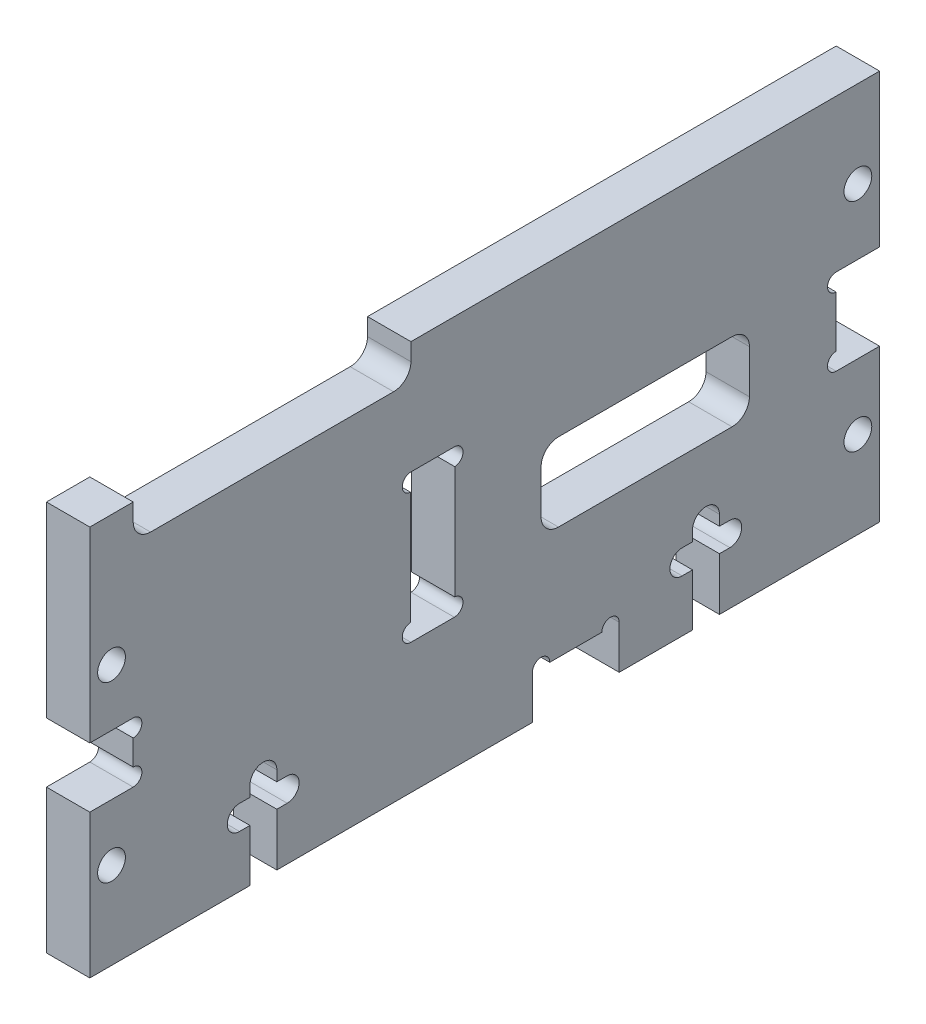
from build123d import *

# Parameters (mm, degrees)
SKETCH_1_W           = 91
SKETCH_1_H           = 45
EXTRUDE_1_DEPTH      = 5
SKETCH_7_W           = 24
SKETCH_7_H           = 9
CUT_EXTRUDE_3_DEPTH  = 10
FILLET_1_R           = 2
SKETCH_8_W           = 32
SKETCH_8_H           = 4
CUT_EXTRUDE_4_DEPTH  = 10
FILLET_2_R           = 2
SKETCH_9_W           = 5
SKETCH_9_H           = 17
CUT_EXTRUDE_5_DEPTH  = 5
SKETCH_14_R          = 1.55
SKETCH_14_R_2        = 1.482519405
CUT_EXTRUDE_9_DEPTH  = 10
SKETCH_10_R          = 1
CUT_EXTRUDE_6_DEPTH  = 10
SKETCH_12_R          = 1.6
CUT_EXTRUDE_7_DEPTH  = 10
CUT_EXTRUDE_8_DEPTH  = 10
SKETCH_15_W          = 10
SKETCH_15_H          = 5
CUT_EXTRUDE_10_DEPTH = 10
SKETCH_19_W          = 5
SKETCH_19_H          = 6.9
SKETCH_19_H_2        = 9.9
CUT_EXTRUDE_14_DEPTH = 5
SKETCH_16_R          = 1
CUT_EXTRUDE_11_DEPTH = 10
SKETCH_20_W          = 5.1
SKETCH_20_H          = 15.197667804
CUT_EXTRUDE_15_DEPTH = 10


with BuildPart() as part:
    # 스케치1 → 보스-돌출1 (new body)
    with BuildSketch(Plane(origin=(0, 0, 0), x_dir=(0, 0, -1), z_dir=(1, 0, 0))):
        with Locations((45.5, 22.5)):
            Rectangle(SKETCH_1_W, SKETCH_1_H)
    extrude(amount=EXTRUDE_1_DEPTH)

    # 스케치7 → 컷-돌출3 (cut)
    with BuildSketch(Plane(origin=(5, 0, 0), x_dir=(0, 0, -1), z_dir=(1, 0, 0))):
        with Locations((64, 22.5)):
            Rectangle(SKETCH_7_W, SKETCH_7_H)
    extrude(amount=-CUT_EXTRUDE_3_DEPTH, mode=Mode.SUBTRACT)

    # 필렛1
    fillet_1_edges = [part.edges().sort_by_distance(p)[0] for p in [
        (2.5, 18, -52),
        (2.5, 27, -52),
        (2.5, 27, -76),
        (2.5, 18, -76),
    ]]
    fillet(fillet_1_edges, radius=FILLET_1_R)

    # 스케치8 → 컷-돌출4 (cut)
    with BuildSketch(Plane(origin=(5, 0, 0), x_dir=(0, 0, -1), z_dir=(1, 0, 0))):
        with Locations((21, 43)):
            Rectangle(SKETCH_8_W, SKETCH_8_H)
    extrude(amount=-CUT_EXTRUDE_4_DEPTH, mode=Mode.SUBTRACT)

    # 필렛2
    fillet_2_edges = [part.edges().sort_by_distance(p)[0] for p in [
        (2.5, 41, -5),
        (2.5, 41, -37),
    ]]
    fillet(fillet_2_edges, radius=FILLET_2_R)

    # 스케치9 → 컷-돌출5 (cut)
    with BuildSketch(Plane.ZY):
        with Locations((-39.5, 23.5)):
            Rectangle(SKETCH_9_W, SKETCH_9_H)
    extrude(amount=-CUT_EXTRUDE_5_DEPTH, mode=Mode.SUBTRACT)

    # 스케치14 → 컷-돌출9 (cut)
    with BuildSketch(Plane(origin=(5, 0, 0), x_dir=(0, 0, -1), z_dir=(1, 0, 0))):
        with Locations((2.5, 10)):
            Circle(SKETCH_14_R)
        with Locations((2.5, 30)):
            Circle(SKETCH_14_R)
        with Locations((88.5, 35.067480595)):
            Circle(SKETCH_14_R_2)
        with Locations((88.5, 10)):
            Circle(SKETCH_14_R)
    extrude(amount=-CUT_EXTRUDE_9_DEPTH, mode=Mode.SUBTRACT)

    # 스케치10 → 컷-돌출6 (cut)
    with BuildSketch(Plane(origin=(5, 0, 0), x_dir=(0, 0, -1), z_dir=(1, 0, 0))):
        with Locations((42, 31)):
            Circle(SKETCH_10_R)
        with Locations((42, 16)):
            Circle(SKETCH_10_R)
        with Locations((37, 16)):
            Circle(SKETCH_10_R)
        with Locations((37, 31)):
            Circle(SKETCH_10_R)
    extrude(amount=-CUT_EXTRUDE_6_DEPTH, mode=Mode.SUBTRACT)

    # 스케치12 → 컷-돌출7 (cut)
    with BuildSketch(Plane(origin=(5, 0, 0), x_dir=(0, 0, -1), z_dir=(1, 0, 0))):
        with Locations((2.5, 30)):
            Circle(SKETCH_12_R)
        with Locations((2.5, 10)):
            Circle(SKETCH_12_R)
        with Locations((88.5, 35)):
            Circle(SKETCH_12_R)
        with Locations((88.5, 10)):
            Circle(SKETCH_12_R)
    extrude(amount=-CUT_EXTRUDE_7_DEPTH, mode=Mode.SUBTRACT)

    # 스케치13 → 컷-돌출8 (cut)
    with BuildSketch(Plane(origin=(5, 0, 0), x_dir=(0, 0, -1), z_dir=(1, 0, 0))):
        with BuildLine():
            Line((18.45, 0), (18.45, 6))
            Line((18.45, 6), (17.250192706, 6))
            ThreePointArc((17.250192706, 6), (15.841386702, 7.391138254), (17.232524956, 8.799944258))
            Line((17.232524956, 8.799944258), (18.45, 8.799944258))
            Line((18.45, 8.799944258), (18.45, 10))
            ThreePointArc((18.45, 10), (20, 11.55), (21.55, 10))
            Line((21.55, 10), (21.55, 8.799872773))
            Line((21.55, 8.799872773), (22.749807294, 8.799872773))
            ThreePointArc((22.749807294, 8.799872773), (24.117188413, 7.432491654), (22.749807294, 6.065110535))
            Line((22.749807294, 6.065110535), (21.55, 6.065110535))
            Line((21.55, 6.065110535), (21.55, 0))
            Line((21.55, 0), (18.45, 0))
        make_face()
        with BuildLine():
            Line((72.55, 0), (72.55, 6.065110535))
            Line((72.55, 6.065110535), (73.749807294, 6.065110535))
            ThreePointArc((73.749807294, 6.065110535), (75.117188413, 7.432491654), (73.749807294, 8.799872773))
            Line((73.749807294, 8.799872773), (72.55, 8.799872773))
            Line((72.55, 8.799872773), (72.55, 10))
            ThreePointArc((72.55, 10), (71, 11.55), (69.45, 10))
            Line((69.45, 10), (69.45, 8.799944258))
            Line((69.45, 8.799944258), (68.232524956, 8.799944258))
            ThreePointArc((68.232524956, 8.799944258), (66.841386702, 7.391138254), (68.250192706, 6))
            Line((68.250192706, 6), (69.45, 6))
            Line((69.45, 6), (69.45, 0))
            Line((69.45, 0), (72.55, 0))
        make_face()
    extrude(amount=-CUT_EXTRUDE_8_DEPTH, mode=Mode.SUBTRACT)

    # 스케치15 → 컷-돌출10 (cut)
    with BuildSketch(Plane(origin=(5, 0, 0), x_dir=(0, 0, -1), z_dir=(1, 0, 0))):
        with Locations((56, 2.5)):
            Rectangle(SKETCH_15_W, SKETCH_15_H)
    extrude(amount=-CUT_EXTRUDE_10_DEPTH, mode=Mode.SUBTRACT)

    # 스케치19 → 컷-돌출14 (cut)
    with BuildSketch(Plane.ZY):
        with Locations((-2.5, 20)):
            Rectangle(SKETCH_19_W, SKETCH_19_H)
        with Locations((-88.5, 22.5)):
            Rectangle(SKETCH_19_W, SKETCH_19_H_2)
    extrude(amount=-CUT_EXTRUDE_14_DEPTH, mode=Mode.SUBTRACT)

    # 스케치16 → 컷-돌출11 (cut)
    with BuildSketch(Plane.ZY):
        with Locations((-60, 5)):
            Circle(SKETCH_16_R)
        with Locations((-52, 5)):
            Circle(SKETCH_16_R)
        with Locations((-86, 26.45)):
            Circle(SKETCH_16_R)
        with Locations((-86, 18.55)):
            Circle(SKETCH_16_R)
        with Locations((-5, 22.45)):
            Circle(SKETCH_16_R)
        with Locations((-5, 17.55)):
            Circle(SKETCH_16_R)
    extrude(amount=-CUT_EXTRUDE_11_DEPTH, mode=Mode.SUBTRACT)

    # 스케치20 → 컷-돌출15 (cut)
    with BuildSketch(Plane(origin=(5, 0, 0), x_dir=(0, 0, -1), z_dir=(1, 0, 0))):
        with Locations((39.5, 23.598833902)):
            Rectangle(SKETCH_20_W, SKETCH_20_H)
    extrude(amount=-CUT_EXTRUDE_15_DEPTH, mode=Mode.SUBTRACT)


solid = part.part
